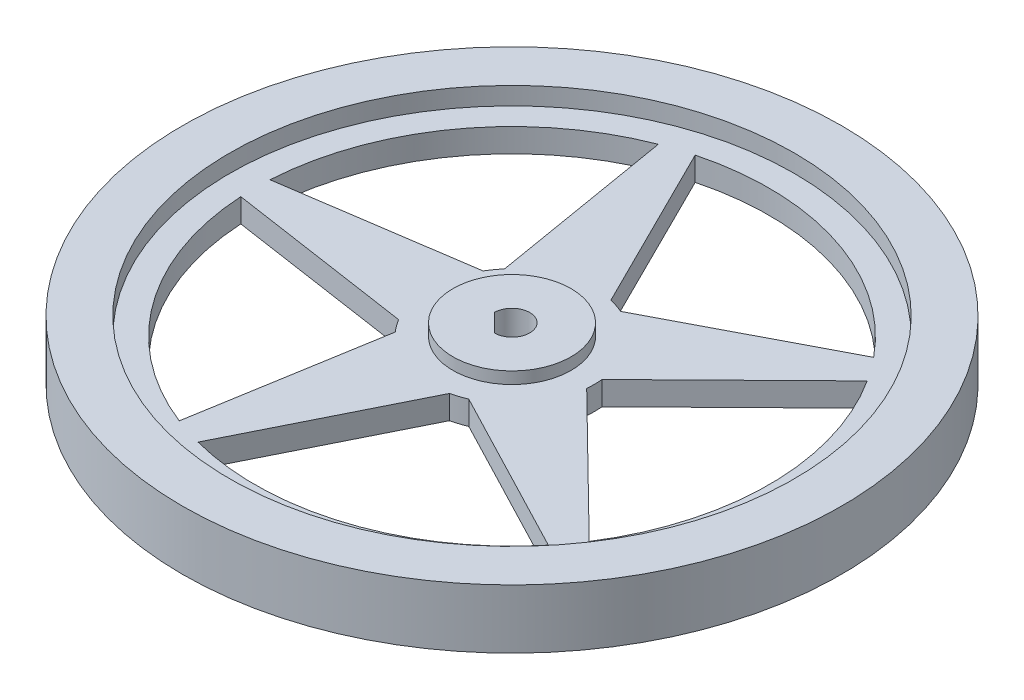
from build123d import *

# Parameters (mm, degrees)
CUT_EXTRUDE1_DEPTH = 10
CUT_EXTRUDE3_DEPTH = 10


with BuildPart() as part:
    # Sketch2 → Revolve1 (revolve)
    with BuildSketch(Plane(origin=(0, 0, 0), x_dir=(0, 0, -1), z_dir=(1, 0, 0))):
        Polygon((-55.78, -4), (-55.78, 4), (-45.78, 4), (-45.78, 2), (-8, 2), (-8, 5), (0, 5), (0, -5), (-8, -5), (-8, -2), (-45.78, -2), (-45.78, -4), align=None)
    revolve(axis=Axis((0, -4, 55.78), (0, 1, 0)))

    # Sketch5 → Cut-Extrude1 (cut)
    with BuildSketch(Plane.XZ.offset(4)):
        with BuildLine():
            Line((-3, 55.78), (0, 58.78))
            ThreePointArc((0, 58.78), (2.121320344, 53.658679656), (-3, 55.78))
        make_face()
    extrude(amount=-CUT_EXTRUDE1_DEPTH, mode=Mode.SUBTRACT)

    # Sketch6 → Cut-Extrude3 (cut)
    with BuildSketch(Plane(origin=(0, -2, 0), x_dir=(-1, 0, 0), z_dir=(0, -1, 0))):
        with BuildLine():
            Line((12.040379463, -48.636523088), (43.429568931, -53.305622821))
            ThreePointArc((43.429568931, -53.305622821), (35.192239255, -30.211341525), (15.773747398, -15.240650067))
            Line((15.773747398, -15.240650067), (10.514532139, -46.536374418))
            ThreePointArc((10.514532139, -46.536374418), (11.326237921, -47.551006468), (12.040379463, -48.636523088))
        make_face()
        with BuildLine():
            ThreePointArc((15.773747398, -96.319349933), (35.192239255, -81.348658475), (43.429568931, -58.254377179))
            Line((43.429568931, -58.254377179), (12.040379463, -62.923476912))
            ThreePointArc((12.040379463, -62.923476912), (11.326237921, -64.008993532), (10.514532139, -65.023625582))
            Line((10.514532139, -65.023625582), (15.773747398, -96.319349933))
        make_face()
        with BuildLine():
            ThreePointArc((-33.680856909, -83.30907332), (-13.442239255, -97.150958459), (11.067202318, -97.848599131))
            Line((11.067202318, -97.848599131), (-3.073168394, -69.438537111))
            ThreePointArc((-3.073168394, -69.438537111), (-4.326237921, -69.094791228), (-5.542041225, -68.636351701))
            Line((-5.542041225, -68.636351701), (-33.680856909, -83.30907332))
        make_face()
        with BuildLine():
            ThreePointArc((-36.589661739, -32.254553057), (-43.5, -55.78), (-36.589661739, -79.305446943))
            Line((-36.589661739, -79.305446943), (-13.939701983, -57.077963259))
            ThreePointArc((-13.939701983, -57.077963259), (-14, -55.78), (-13.939701983, -54.482036741))
            Line((-13.939701983, -54.482036741), (-36.589661739, -32.254553057))
        make_face()
        with BuildLine():
            Line((-3.073168394, -42.121462889), (11.067202318, -13.711400869))
            ThreePointArc((11.067202318, -13.711400869), (-13.442239255, -14.409041541), (-33.680856909, -28.25092668))
            Line((-33.680856909, -28.25092668), (-5.542041225, -42.923648299))
            ThreePointArc((-5.542041225, -42.923648299), (-4.326237921, -42.465208772), (-3.073168394, -42.121462889))
        make_face()
    extrude(amount=-CUT_EXTRUDE3_DEPTH, mode=Mode.SUBTRACT)


solid = part.part
